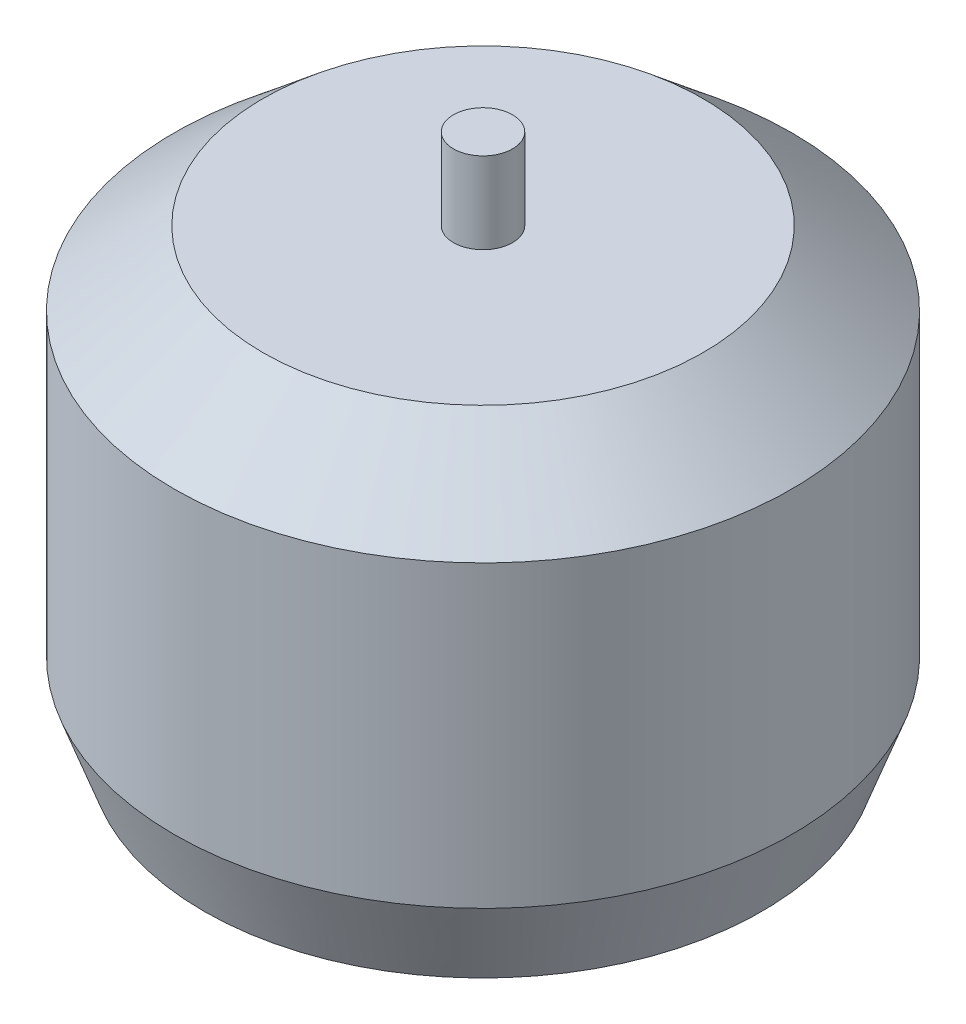
from build123d import *

# Parameters (mm, degrees)
SKETCH1_R           = 20.9
BOSS_EXTRUDE1_DEPTH = 30.75
CHAMFER1_SIZE       = 5
CHAMFER1_SIZE2      = 6
CHAMFER2_SIZE       = 2
CHAMFER2_SIZE2      = 5.494954839
SKETCH2_R           = 2
BOSS_EXTRUDE2_DEPTH = 5.5
SKETCH3_R           = 4
BOSS_EXTRUDE3_DEPTH = 2.55
SKETCH4_R           = 4
SKETCH4_R_2         = 1
CUT_EXTRUDE1_DEPTH  = 1.5875


with BuildPart() as part:
    # Sketch1 → Boss-Extrude1 (new body)
    with BuildSketch(Plane(origin=(0, 0, 0), x_dir=(1, 0, 0), z_dir=(0, 1, 0))):
        with Locations(Location((-5.649057894, -5.328088696, 0), (0, 0, 270))):
            Circle(SKETCH1_R)
    extrude(amount=BOSS_EXTRUDE1_DEPTH)

    # Chamfer1
    chamfer1_edges = [part.edges().sort_by_distance(p)[0] for p in [
        (-5.649057894, 30.75, -15.571911304),
    ]]
    chamfer1_side = [part.faces().sort_by_distance(p)[0] for p in [
        (-5.649057894, 15.375, -15.571911304),
    ]]
    chamfer(chamfer1_edges, length=CHAMFER1_SIZE, length2=CHAMFER1_SIZE2, reference=chamfer1_side[0])

    # Chamfer2
    chamfer2_edges = [part.edges().sort_by_distance(p)[0] for p in [
        (-5.649057894, 0, -15.571911304),
    ]]
    chamfer2_side = [part.faces().sort_by_distance(p)[0] for p in [
        (-5.649057894, 0, 5.328088696),
    ]]
    chamfer(chamfer2_edges, length=CHAMFER2_SIZE, length2=CHAMFER2_SIZE2, reference=chamfer2_side[0])

    # Sketch2 → Boss-Extrude2 (add)
    with BuildSketch(Plane(origin=(0, 30.75, 0), x_dir=(1, 0, 0), z_dir=(0, 1, 0))):
        with Locations(Location((-5.649057894, -5.328088696, 0), (0, 0, 270))):
            Circle(SKETCH2_R)
    extrude(amount=BOSS_EXTRUDE2_DEPTH)

    # Sketch3 → Boss-Extrude3 (add)
    with BuildSketch(Plane.XZ):
        with Locations(Location((-5.649057894, 5.328088696, 0), (0, 0, 90))):
            Circle(SKETCH3_R)
    extrude(amount=BOSS_EXTRUDE3_DEPTH)

    # Sketch4 → Cut-Extrude1 (cut)
    with BuildSketch(Plane.XZ):
        with Locations(Location((-5.908658192, 17.486035989, 0), (0, 0, 270))):
            Circle(SKETCH4_R)
        with Locations(Location((-5.908658192, -6.829858597, 0), (0, 0, 90))):
            Circle(SKETCH4_R)
        with Locations(Location((-17.807005187, 5.587688994, 0), (0, 0, 90))):
            Circle(SKETCH4_R)
        with Locations(Location((5.989688802, 5.587688994, 0), (0, 0, 270))):
            Circle(SKETCH4_R)
        with Locations(Location((-12.366572316, 12.045603117, 0), (0, 0, 270))):
            Circle(SKETCH4_R_2)
        with Locations(Location((1.068456527, -1.389425725, 0), (0, 0, 90))):
            Circle(SKETCH4_R_2)
        with Locations(Location((-11.305912144, -0.328765554, 0), (0, 0, 270))):
            Circle(SKETCH4_R_2)
        with Locations(Location((0.007796355, 10.984942945, 0), (0, 0, 90))):
            Circle(SKETCH4_R_2)
        with Locations(Location((-14.487892659, -3.510746069, 0), (0, 0, 270))):
            Circle(SKETCH4_R_2)
        with Locations(Location((3.18977687, 14.166923461, 0), (0, 0, 90))):
            Circle(SKETCH4_R_2)
    extrude(amount=-CUT_EXTRUDE1_DEPTH, mode=Mode.SUBTRACT)


solid = part.part
